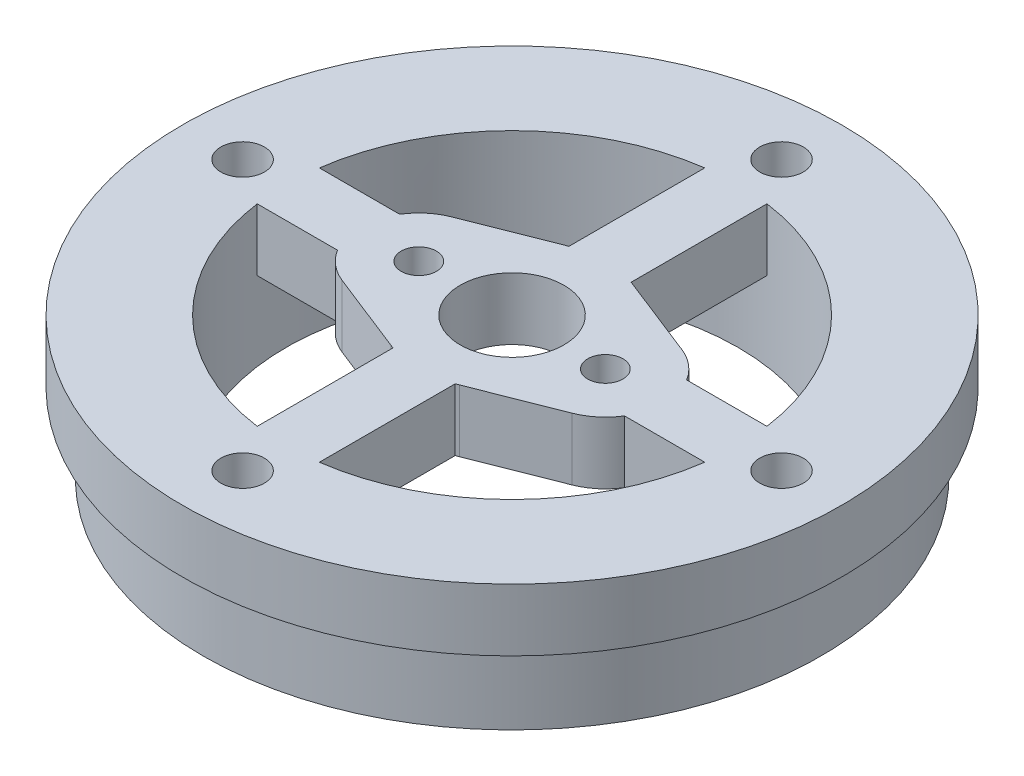
from build123d import *

# Parameters (mm, degrees)
HOLE_WIZARD_1_7_1_7_1_D     = 1.7
HOLE_WIZARD_1_7_1_7_1_DEPTH = 6
HOLE_WIZARD_2_1_2_1_1_D     = 2.1
CUT_EXTRUDE_START           = -10
CUT_EXTRUDE_1_DEPTH         = 10


with BuildPart() as part:
    # 草图2 → 旋转1 (revolve)
    with BuildSketch(Plane.XY, mode=Mode.PRIVATE) as revolve_1_sk:
        Polygon((2.5, 6.8), (15.9, 6.8), (15.9, 3.8), (14.9, 3.8), (14.9, 0), (10.9, 0), (10.9, 3.8), (2.5, 3.8), align=None)
    revolve(revolve_1_sk.sketch.rotate(Axis((0, 0, 0), (0, 1, 0)), 90), axis=Axis((0, 0, 0), (0, 1, 0)))

    # Ø1.7 (1.7) 直径孔1
    with Locations(Plane(origin=(0, 6.8, 0), x_dir=(1, 0, 0), z_dir=(0, 1, 0))):
        with Locations((-4.5, 0), (4.5, 0)):
            Hole(HOLE_WIZARD_1_7_1_7_1_D / 2, depth=HOLE_WIZARD_1_7_1_7_1_DEPTH)

    # Ø2.1 (2.1) 直径孔1 (through all)
    with Locations(Plane(origin=(0, 0, 0), x_dir=(-1, 0, 0), z_dir=(0, -1, 0))):
        with Locations((-13, 0), (0, 13), (13, 0), (0, -13)):
            Hole(HOLE_WIZARD_2_1_2_1_1_D / 2)

    # 草图9 → 切除-拉伸1 (cut)
    with BuildSketch(Plane.XZ.offset(-3.8).offset(CUT_EXTRUDE_START)):
        with BuildLine():
            Line((-5.545, 2.65150429), (-1.65, 4.186585721))
            ThreePointArc((-1.65, 4.186585721), (-1.575249358, 4.215280472), (-1.5, 4.242640687))
            Line((-1.5, 4.242640687), (-1.5, 10.796295661))
            ThreePointArc((-1.5, 10.796295661), (-7.707463915, 7.707463915), (-10.796295661, 1.5))
            Line((-10.796295661, 1.5), (-6.923324163, 1.5))
            ThreePointArc((-6.923324163, 1.5), (-6.327240722, 2.187165138), (-5.545, 2.65150429))
        make_face()
        with BuildLine():
            ThreePointArc((-5.545, -2.65150429), (-6.327240722, -2.187165138), (-6.923324163, -1.5))
            Line((-6.923324163, -1.5), (-10.796295661, -1.5))
            ThreePointArc((-10.796295661, -1.5), (-7.707463915, -7.707463915), (-1.5, -10.796295661))
            Line((-1.5, -10.796295661), (-1.5, -4.242640687))
            ThreePointArc((-1.5, -4.242640687), (-1.575249358, -4.215280472), (-1.65, -4.186585721))
            Line((-1.65, -4.186585721), (-5.545, -2.65150429))
        make_face()
        with BuildLine():
            Line((1.5, 10.796295661), (1.5, 4.242640687))
            ThreePointArc((1.5, 4.242640687), (1.575249358, 4.215280472), (1.65, 4.186585721))
            Line((1.65, 4.186585721), (5.545, 2.65150429))
            ThreePointArc((5.545, 2.65150429), (6.327240722, 2.187165138), (6.923324163, 1.5))
            Line((6.923324163, 1.5), (10.796295661, 1.5))
            ThreePointArc((10.796295661, 1.5), (7.707463915, 7.707463915), (1.5, 10.796295661))
        make_face()
        with BuildLine():
            ThreePointArc((1.65, -4.186585721), (1.575249358, -4.215280472), (1.5, -4.242640687))
            Line((1.5, -4.242640687), (1.5, -10.796295661))
            ThreePointArc((1.5, -10.796295661), (7.707463915, -7.707463915), (10.796295661, -1.5))
            Line((10.796295661, -1.5), (6.923324163, -1.5))
            ThreePointArc((6.923324163, -1.5), (6.327240722, -2.187165138), (5.545, -2.65150429))
            Line((5.545, -2.65150429), (1.65, -4.186585721))
        make_face()
    extrude(amount=CUT_EXTRUDE_1_DEPTH, mode=Mode.SUBTRACT)


solid = part.part
